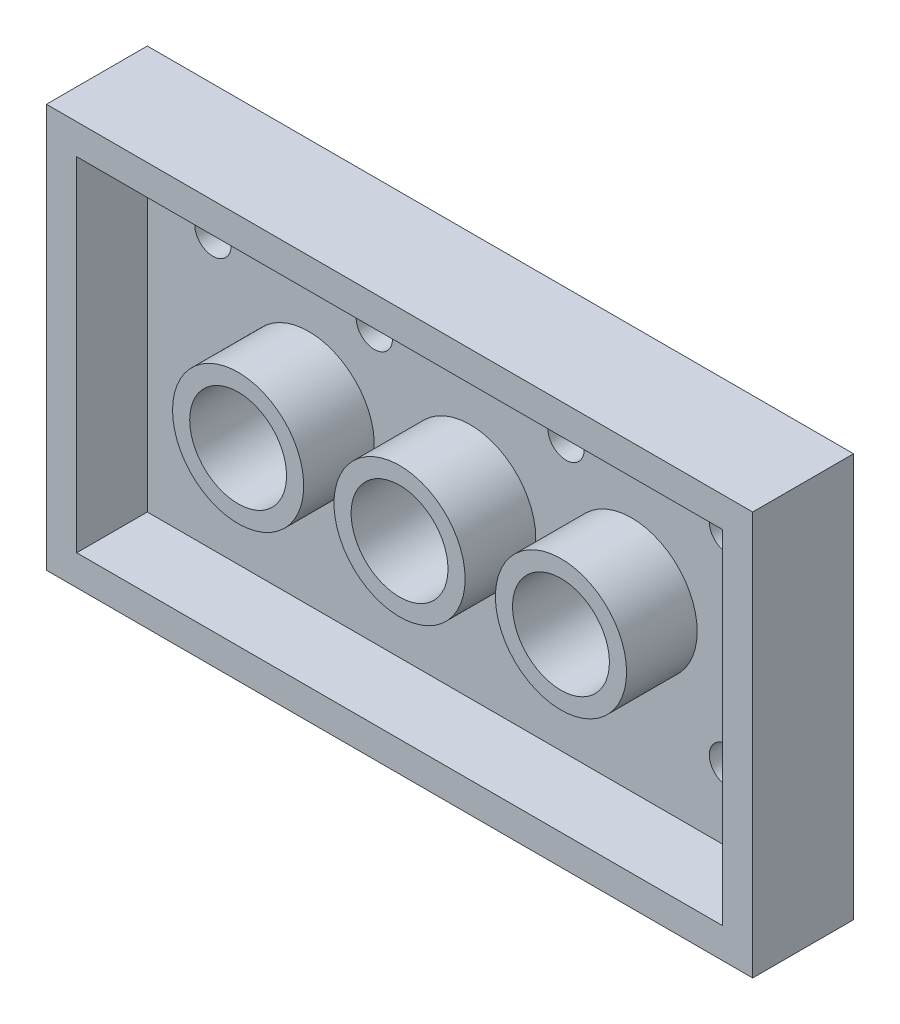
from build123d import *

# Parameters (mm, degrees)
SKETCH1_W           = 35
SKETCH1_H           = 20
SKETCH1_W_2         = 32
SKETCH1_H_2         = 17
BOSS_EXTRUDE1_DEPTH = 5
SKETCH2_W           = 32
SKETCH2_H           = 17
BOSS_EXTRUDE2_DEPTH = 1.5
SKETCH3_R           = 2.4
BOSS_EXTRUDE3_DEPTH = 1.8
SKETCH6_R           = 3.25
SKETCH6_R_2         = 2.4
BOSS_EXTRUDE4_DEPTH = 3.5
SKETCH7_R           = 0.9
CUT_EXTRUDE2_DEPTH  = 1.8


with BuildPart() as part:
    # Sketch1 → Boss-Extrude1 (new body)
    with BuildSketch(Plane.XY):
        Rectangle(SKETCH1_W, SKETCH1_H)
        Rectangle(SKETCH1_W_2, SKETCH1_H_2, mode=Mode.SUBTRACT)
    extrude(amount=BOSS_EXTRUDE1_DEPTH)

    # Sketch2 → Boss-Extrude2 (add)
    with BuildSketch(Plane.XY):
        Rectangle(SKETCH2_W, SKETCH2_H)
    extrude(amount=BOSS_EXTRUDE2_DEPTH)

    # Sketch3 → Boss-Extrude3 (add)
    with BuildSketch(Plane(origin=(0, 0, 0), x_dir=(-1, 0, 0), z_dir=(0, 0, -1))):
        with BuildLine():
            ThreePointArc((15.15, -5), (14.447056275, -3.302943725), (12.75, -2.6))
            Line((12.75, -2.6), (12.75, -5))
            Line((12.75, -5), (15.15, -5))
        make_face()
        with BuildLine():
            Line((12.75, -5), (12.75, -2.6))
            ThreePointArc((12.75, -2.6), (11.052943725, -3.302943725), (10.35, -5))
            Line((10.35, -5), (12.75, -5))
        make_face()
        with BuildLine():
            Line((12.75, -7.4), (12.75, -5))
            Line((12.75, -5), (10.35, -5))
            ThreePointArc((10.35, -5), (11.052943725, -6.697056275), (12.75, -7.4))
        make_face()
        with BuildLine():
            Line((15.15, -5), (12.75, -5))
            Line((12.75, -5), (12.75, -7.4))
            ThreePointArc((12.75, -7.4), (14.447056275, -6.697056275), (15.15, -5))
        make_face()
        with Locations((12.75, 5)):
            Circle(SKETCH3_R)
        with Locations((-4.75, 5)):
            Circle(SKETCH3_R)
        with Locations((-4.75, -5)):
            Circle(SKETCH3_R)
        with Locations((-12.75, -5)):
            Circle(SKETCH3_R)
        with Locations((-12.75, 5)):
            Circle(SKETCH3_R)
        with Locations((4.75, -5)):
            Circle(SKETCH3_R)
        with Locations(Location((4.75, 5, 0), (0, 0, 180))):
            Circle(SKETCH3_R)
    extrude(amount=BOSS_EXTRUDE3_DEPTH)

    # Sketch6 → Boss-Extrude4 (add)
    # profile 1 of 3: a face of its own
    with BuildSketch(Plane.XY.offset(1.5)):
        Circle(SKETCH6_R)
        Circle(SKETCH6_R_2, mode=Mode.SUBTRACT)
    # profile 2 of 3: a face of its own
    with BuildSketch(Plane.XY.offset(1.5)):
        with Locations((8, 0)):
            Circle(SKETCH6_R)
        with Locations((8, 0)):
            Circle(SKETCH6_R_2, mode=Mode.SUBTRACT)
    # profile 3 of 3: a face of its own
    with BuildSketch(Plane.XY.offset(1.5)):
        with Locations(Location((-8, 0, 0), (0, 0, 180))):
            Circle(SKETCH6_R)
        with Locations(Location((-8, 0, 0), (0, 0, 180))):
            Circle(SKETCH6_R_2, mode=Mode.SUBTRACT)
    extrude(amount=BOSS_EXTRUDE4_DEPTH)

    # Sketch7 → Cut-Extrude2 (cut)
    with BuildSketch(Plane.XY.offset(1.5)):
        with Locations((12.75, 5)):
            Circle(SKETCH7_R)
        with Locations((-12.75, 5)):
            Circle(SKETCH7_R)
        with Locations((-12.75, -5)):
            Circle(SKETCH7_R)
        with Locations((-4.75, -5)):
            Circle(SKETCH7_R)
        with Locations((12.75, -5)):
            Circle(SKETCH7_R)
        with Locations(Location((4.75, 5, 0), (0, 0, 180))):
            Circle(SKETCH7_R)
        with Locations((-4.75, 5)):
            Circle(SKETCH7_R)
        with Locations((4.75, -5)):
            Circle(SKETCH7_R)
    extrude(amount=-CUT_EXTRUDE2_DEPTH, mode=Mode.SUBTRACT)


solid = part.part
